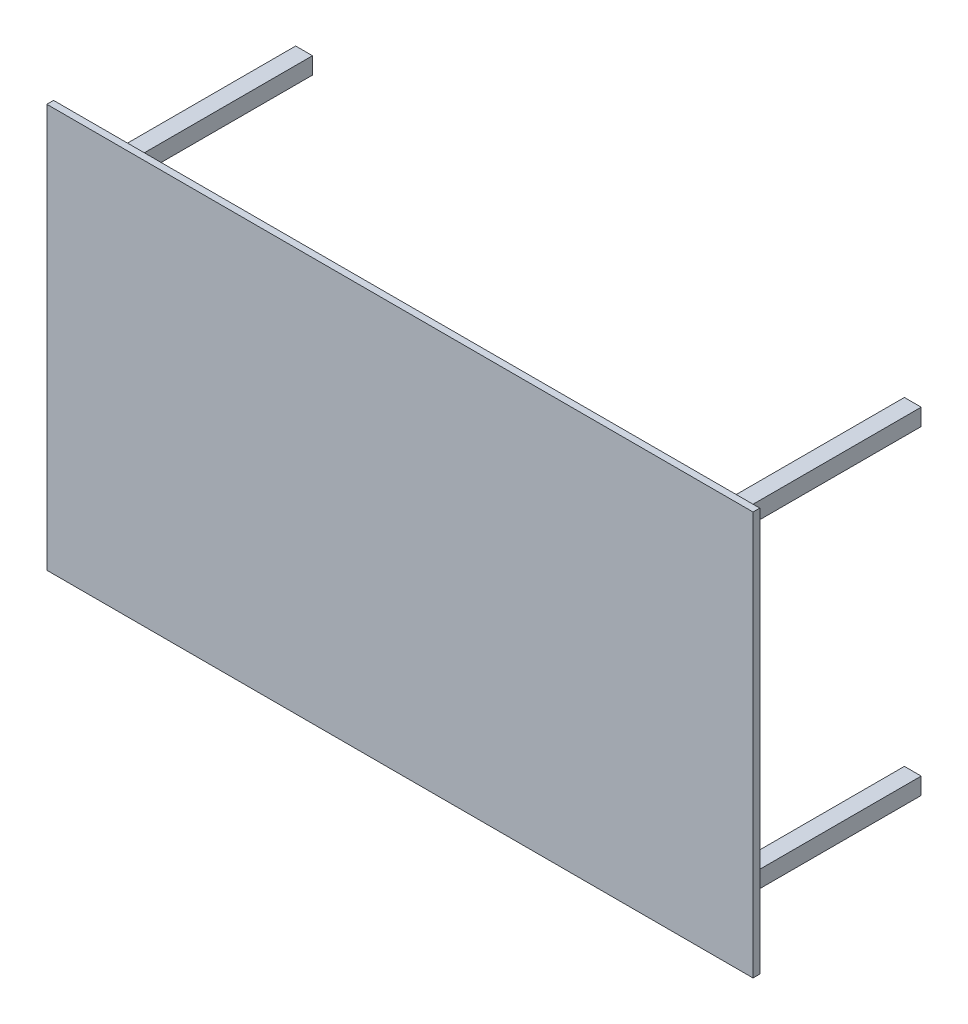
from build123d import *

# Parameters (mm, degrees)
ESBO_O1_W                = 2100
ESBO_O1_H                = 1200
RESSALTO_EXTRUS_O1_DEPTH = 20
ESBO_O2_W                = 50
ESBO_O2_H                = 50
RESSALTO_EXTRUS_O2_DEPTH = 600


with BuildPart() as part:
    # Esboço1 → Ressalto-extrusão1 (new body)
    with BuildSketch(Plane.XY):
        Rectangle(ESBO_O1_W, ESBO_O1_H)
    extrude(amount=RESSALTO_EXTRUS_O1_DEPTH)

    # Esboço2 → Ressalto-extrusão2 (add)
    with BuildSketch(Plane(origin=(0, 0, 0), x_dir=(-1, 0, 0), z_dir=(0, 0, -1))):
        with Locations((-905, 475)):
            Rectangle(ESBO_O2_W, ESBO_O2_H)
        with Locations((905, -475)):
            Rectangle(ESBO_O2_W, ESBO_O2_H)
        with Locations((-905, -475)):
            Rectangle(ESBO_O2_W, ESBO_O2_H)
        with Locations((905, 475)):
            Rectangle(ESBO_O2_W, ESBO_O2_H)
    extrude(amount=RESSALTO_EXTRUS_O2_DEPTH)


solid = part.part
